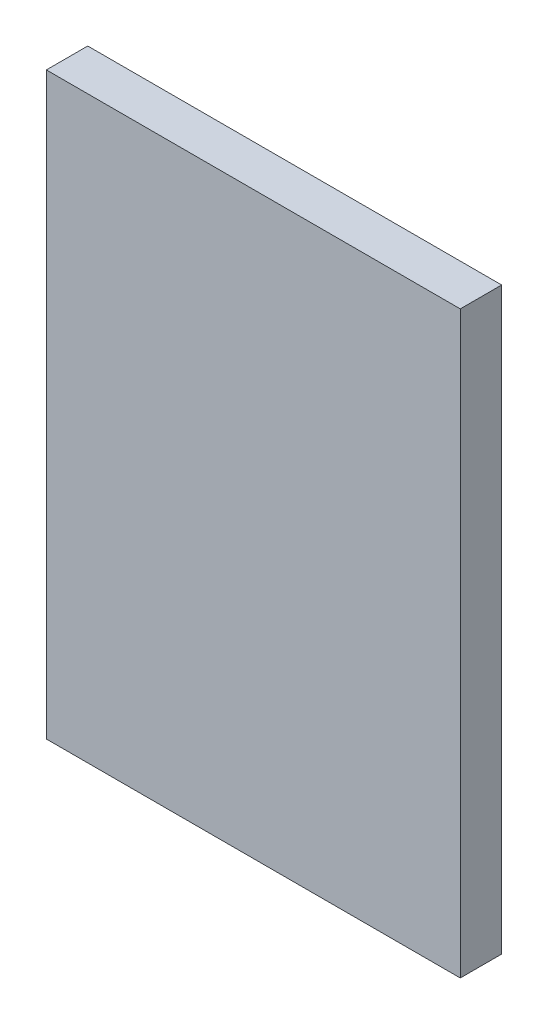
from build123d import *

# Parameters (mm, degrees)
CROQUIS2_W              = 500
CROQUIS2_H              = 700
SALIENTE_EXTRUIR1_DEPTH = 50


with BuildPart() as part:
    # Croquis2 → Saliente-Extruir1 (new body)
    with BuildSketch(Plane.XY):
        with Locations((250, 350)):
            Rectangle(CROQUIS2_W, CROQUIS2_H)
    extrude(amount=SALIENTE_EXTRUIR1_DEPTH)


solid = part.part
